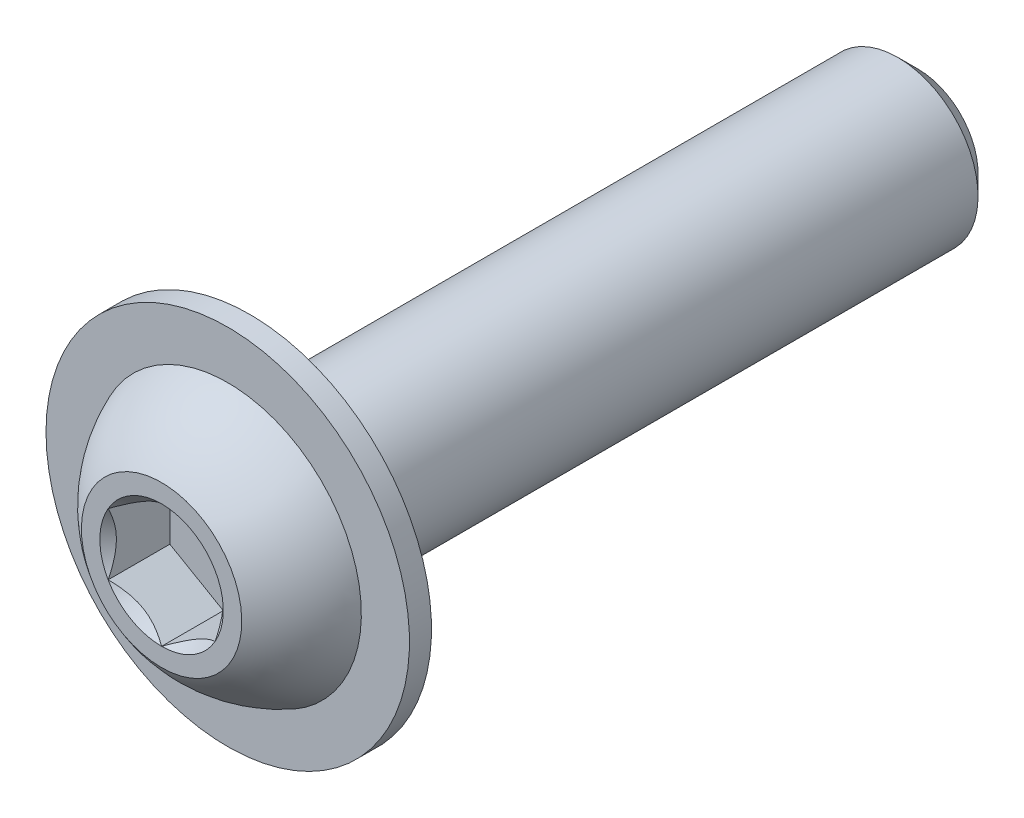
from build123d import *

# Parameters (mm, degrees)
SKETCH1_W           = 25
SKETCH1_H           = 3
CHAMFER1_SIZE       = 0.75
SKETCH11_R          = 6.8
BOSS_EXTRUDE3_DEPTH = 0.825
CUT_EXTRUDE2_DEPTH  = 2.31


with BuildPart() as part:
    # Sketch1 → Revolve1 (revolve)
    with BuildSketch(Plane(origin=(0, 0, 0), x_dir=(0, 0, -1), z_dir=(1, 0, 0))):
        with Locations((15.8, 1.5)):
            Rectangle(SKETCH1_W, SKETCH1_H)
    revolve(axis=Axis((0, 0, -28.3), (0, 0, 1)))

    # Chamfer1
    chamfer1_edges = [part.edges().sort_by_distance(p)[0] for p in [
        (0, -3, -28.3),
    ]]
    chamfer(chamfer1_edges, length=CHAMFER1_SIZE)

    # Sketch7 → Revolve2 (revolve)
    with BuildSketch(Plane(origin=(0, 0, 0), x_dir=(0, 0, -1), z_dir=(1, 0, 0)), mode=Mode.PRIVATE) as revolve2_sk:
        with BuildLine():
            Line((2.475, 5), (3.3, 5))
            Line((3.3, 5), (3.3, 0))
            Line((3.3, 0), (0, 0))
            Line((0, 0), (0, 3))
            ThreePointArc((0, 3), (1.086346695, 4.187052215), (2.475, 5))
        make_face()
    revolve(revolve2_sk.sketch.rotate(Axis((0, 0, 0), (0, 0, -1)), 180), axis=Axis((0, 0, 0), (0, 0, -1)))

    # Sketch11 → Boss-Extrude3 (add)
    with BuildSketch(Plane(origin=(0, 0, -3.3), x_dir=(-1, 0, 0), z_dir=(0, 0, -1))):
        Circle(SKETCH11_R)
    extrude(amount=-BOSS_EXTRUDE3_DEPTH)

    # Sketch5 → Cut-Extrude2 (cut)
    with BuildSketch(Plane.XY):
        Polygon((2, -1.154700538), (2, 1.154700538), (0, 2.309401077), (-2, 1.154700538), (-2, -1.154700538), (0, -2.309401077), align=None)
    extrude(amount=-CUT_EXTRUDE2_DEPTH, mode=Mode.SUBTRACT)

    # Cut-Extrude3 cone 1 section (through the dimple's axis) → Cut-Extrude3 (revolve, cut)
    with BuildSketch(Plane(origin=(0, 0, 0), x_dir=(0, -1, 0), z_dir=(1, 0, 0))):
        Polygon((0, 0), (2.309401077, 0), (0, 2.309401077), align=None)
    revolve(axis=Axis((0, 0, 0), (0, 0, -1)), mode=Mode.SUBTRACT)


solid = part.part
